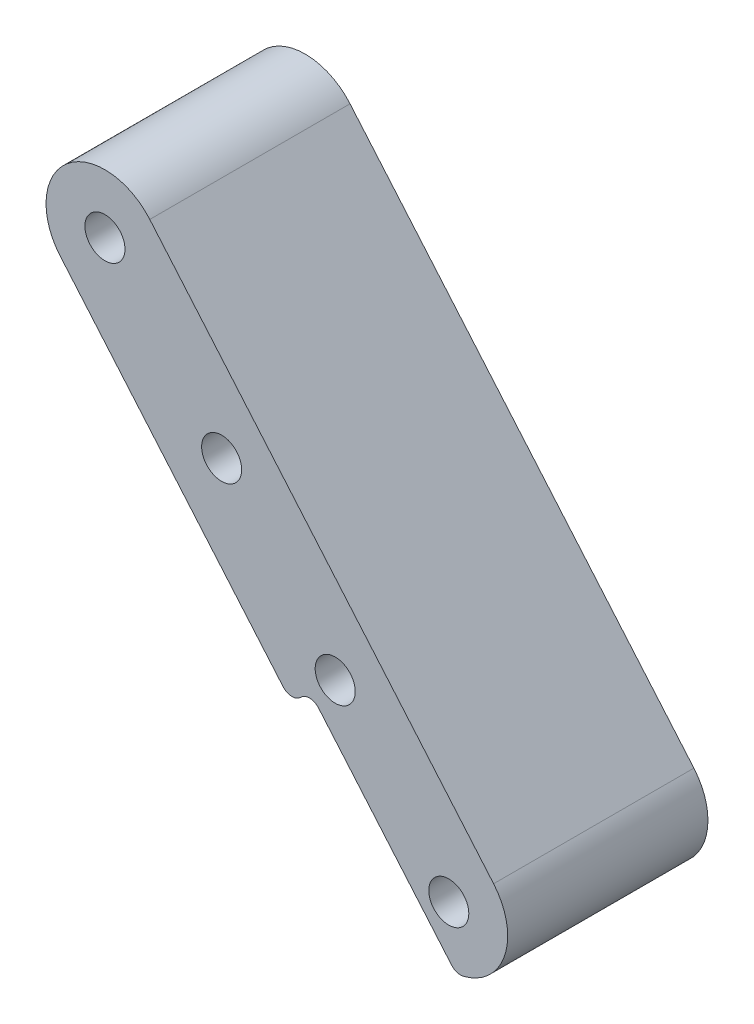
from build123d import *

# Parameters (mm, degrees)
SKETCH_1_R          = 3.4
EXTRUDE_3_DEPTH     = 34
CUT_EXTRUDE_1_DEPTH = 164.659924305
FILLET_1_R          = 2


with BuildPart() as part:
    # 草图1 → 凸台-拉伸3 (new body)
    with BuildSketch(Plane.XY):
        with BuildLine():
            Line((41.331697392, -38.327914958), (99.709351413, -106.819410926))
            ThreePointArc((99.709351413, -106.819410926), (98.585524286, -120.916822482), (84.48811273, -119.792995355))
            Line((84.48811273, -119.792995355), (26.110458709, -51.301499387))
            ThreePointArc((26.110458709, -51.301499387), (27.234285836, -37.204087831), (41.331697392, -38.327914958))
        make_face()
        with Locations((33.721078051, -44.814707172)):
            Circle(SKETCH_1_R, mode=Mode.SUBTRACT)
        with Locations((53.53147549, -67.343536554)):
            Circle(SKETCH_1_R, mode=Mode.SUBTRACT)
        with Locations((72.815103781, -90.324869847)):
            Circle(SKETCH_1_R, mode=Mode.SUBTRACT)
        with Locations((92.098732071, -113.306203141)):
            Circle(SKETCH_1_R, mode=Mode.SUBTRACT)
    extrude(amount=EXTRUDE_3_DEPTH)

    # 草图2 → 切除-拉伸1 (cut, through all)
    with BuildSketch(Plane.XY.offset(34)):
        with BuildLine():
            ThreePointArc((84.48811273, -119.792995355), (88.47574874, -122.626824996), (93.330431012, -123.230059131))
            Line((93.330431012, -123.230059131), (68.680620596, -94.309705633))
            Line((68.680620596, -94.309705633), (65.255841892, -97.228762129))
            Line((65.255841892, -97.228762129), (84.48811273, -119.792995355))
        make_face()
    extrude(amount=-CUT_EXTRUDE_1_DEPTH, mode=Mode.SUBTRACT)

    # 圆角1
    fillet_1_edges = [part.edges().sort_by_distance(p)[0] for p in [
        (68.680620596, -94.309705633, 17),
        (93.330431012, -123.230059131, 17),
        (65.255841892, -97.228762129, 17),
    ]]
    fillet(fillet_1_edges, radius=FILLET_1_R)


solid = part.part
